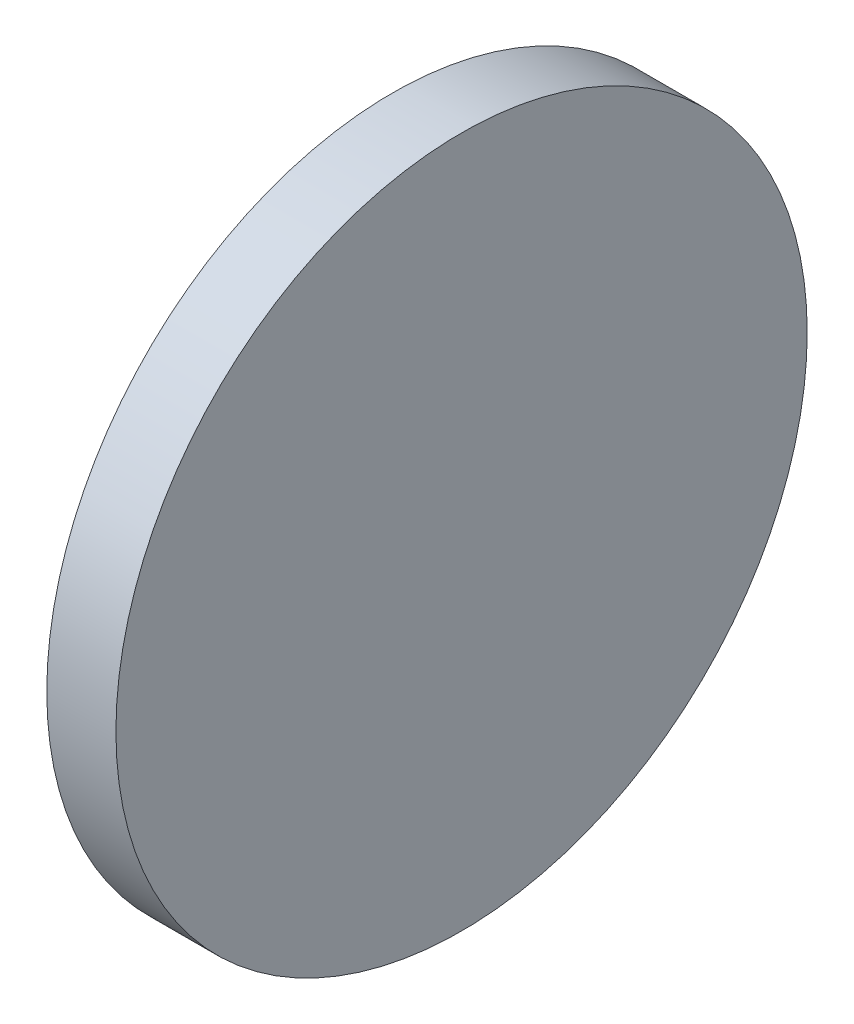
from build123d import *

# Parameters (mm, degrees)
SKETCH_1_R      = 7.5
EXTRUDE_1_DEPTH = 1.5


with BuildPart() as part:
    # 草图1 → 凸台-拉伸1 (new body)
    with BuildSketch(Plane(origin=(0, 0, 0), x_dir=(0, 0, -1), z_dir=(1, 0, 0))):
        Circle(SKETCH_1_R)
    extrude(amount=EXTRUDE_1_DEPTH)


solid = part.part
